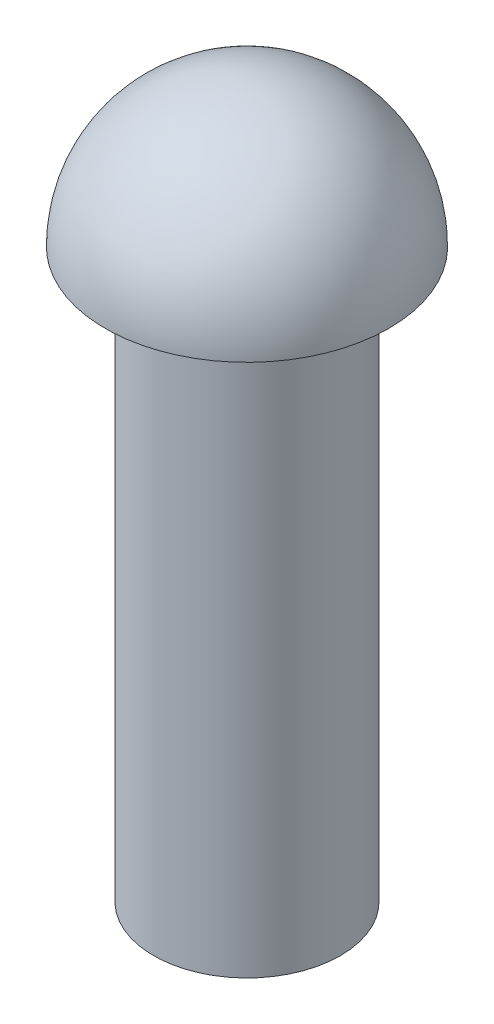
from build123d import *


with BuildPart() as part:
    # Sketch1 → Revolve1 (revolve)
    with BuildSketch(Plane.XY):
        with BuildLine():
            Line((-15, 60), (-9.873417722, 60))
            Line((-9.873417722, 60), (-9.873417722, 0))
            Line((-9.873417722, 0), (0, 0))
            Line((0, 0), (0, 60))
            Line((0, 60), (0, 75))
            ThreePointArc((0, 75), (-10.606601718, 70.606601718), (-15, 60))
        make_face()
    revolve(axis=Axis((0, 60, 0), (0, 1, 0)))


solid = part.part
